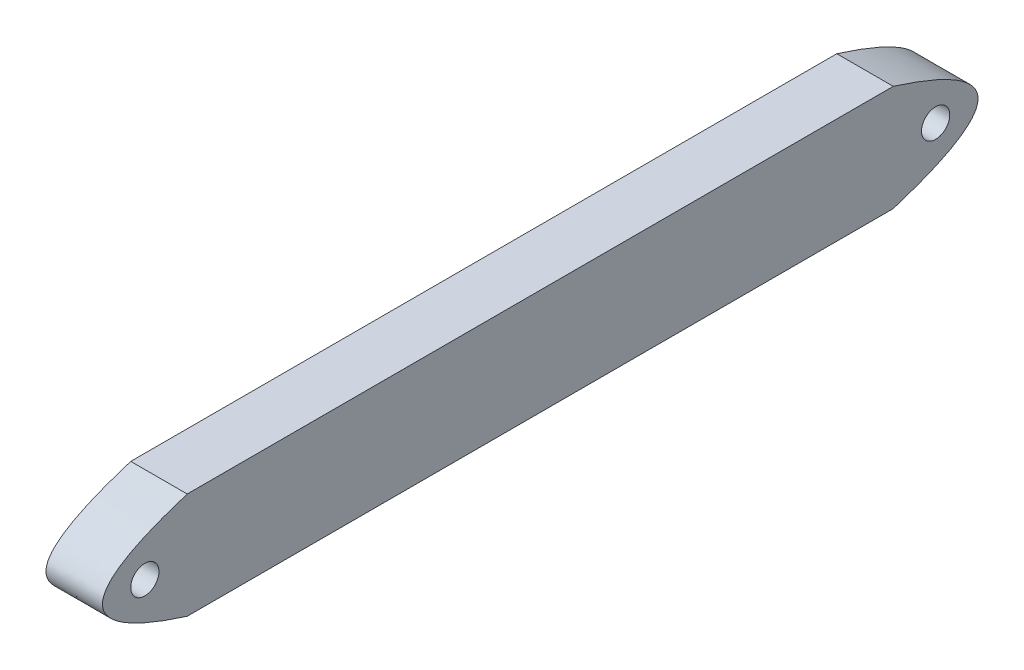
from build123d import *

# Parameters (mm, degrees)
SKETCH1_R           = 2
BOSS_EXTRUDE1_DEPTH = 8


with BuildPart() as part:
    # Sketch1 → Boss-Extrude1 (new body)
    with BuildSketch(Plane(origin=(0, 0, 0), x_dir=(0, 0, -1), z_dir=(1, 0, 0))):
        with BuildLine():
            Line((62.14835845, -8.501725608), (162.14835845, -8.501725608))
            add(Edge.make_bspline(
                [(162.14835845, -8.501725608), (186.14835845, -16.001725608), (162.14835845, -23.501725608)],
                knots=[0, 0, 0, 1, 1, 1], degree=2))
            Line((162.14835845, -23.501725608), (62.14835845, -23.501725608))
            add(Edge.make_bspline(
                [(62.14835845, -8.501725608), (38.14835845, -16.001725608), (62.14835845, -23.501725608)],
                knots=[0, 0, 0, 1, 1, 1], degree=2))
        make_face()
        with Locations((56.14835845, -16.001725608)):
            Circle(SKETCH1_R, mode=Mode.SUBTRACT)
        with Locations((168.14835845, -16.001725608)):
            Circle(SKETCH1_R, mode=Mode.SUBTRACT)
    extrude(amount=BOSS_EXTRUDE1_DEPTH)


solid = part.part
